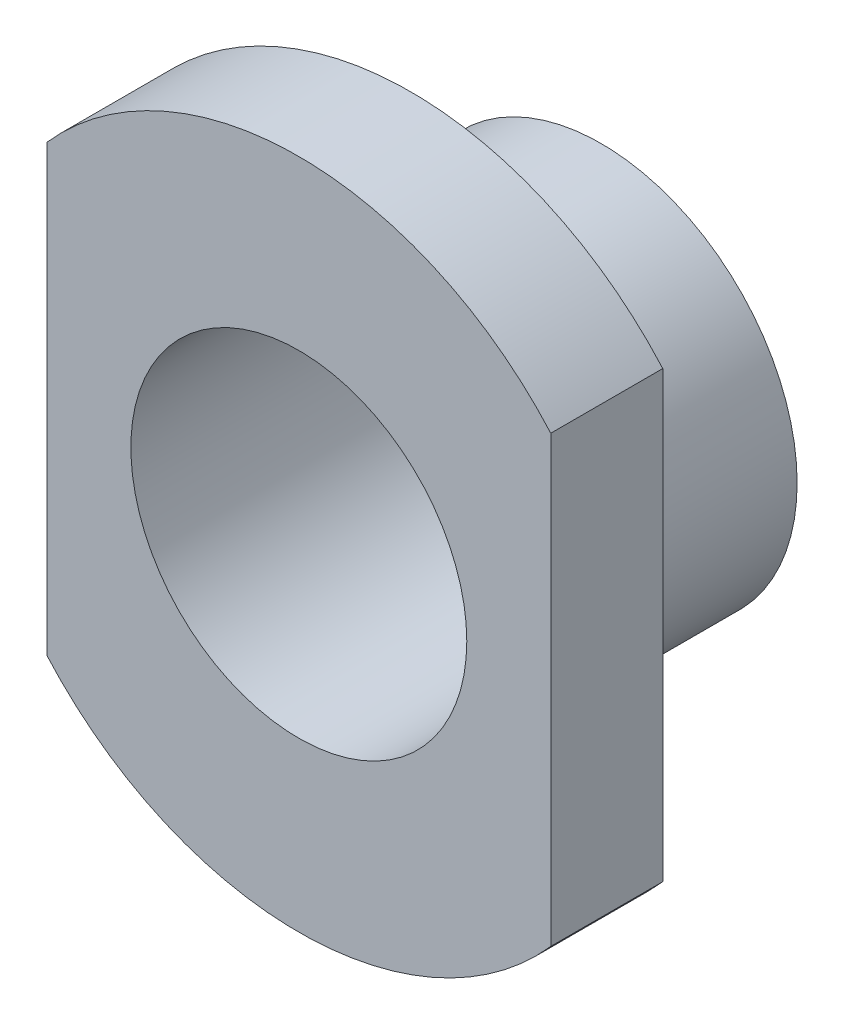
from build123d import *

# Parameters (mm, degrees)
SKETCH_1_R      = 1.75
SKETCH_1_R_2    = 1.5
EXTRUDE_1_DEPTH = 1.7
SKETCH_2_R      = 1.75
SKETCH_2_R_2    = 1.5
EXTRUDE_2_DEPTH = 1


with BuildPart() as part:
    # 草图1 → 凸台-拉伸1 (new body)
    with BuildSketch(Plane.XY):
        Circle(SKETCH_1_R)
        Circle(SKETCH_1_R_2, mode=Mode.SUBTRACT)
    extrude(amount=EXTRUDE_1_DEPTH)

    # 草图2 → 凸台-拉伸2 (add)
    # profile 1 of 2: a face of its own
    with BuildSketch(Plane.XY.offset(1.7)):
        with BuildLine():
            ThreePointArc((-2.25, -1.984313483), (-1.234313483, -2.734313483), (0, -3))
            ThreePointArc((0, -3), (1.234313483, -2.734313483), (2.25, -1.984313483))
            Line((2.25, -1.984313483), (2.25, 1.984313483))
            ThreePointArc((2.25, 1.984313483), (1.234313483, 2.734313483), (0, 3))
            ThreePointArc((0, 3), (-1.234313483, 2.734313483), (-2.25, 1.984313483))
            Line((-2.25, 1.984313483), (-2.25, -1.984313483))
        make_face()
        Circle(SKETCH_2_R, mode=Mode.SUBTRACT)
    # profile 2 of 2: a face of its own
    with BuildSketch(Plane.XY.offset(1.7)):
        Circle(SKETCH_2_R)
        Circle(SKETCH_2_R_2, mode=Mode.SUBTRACT)
    extrude(amount=EXTRUDE_2_DEPTH)


solid = part.part
